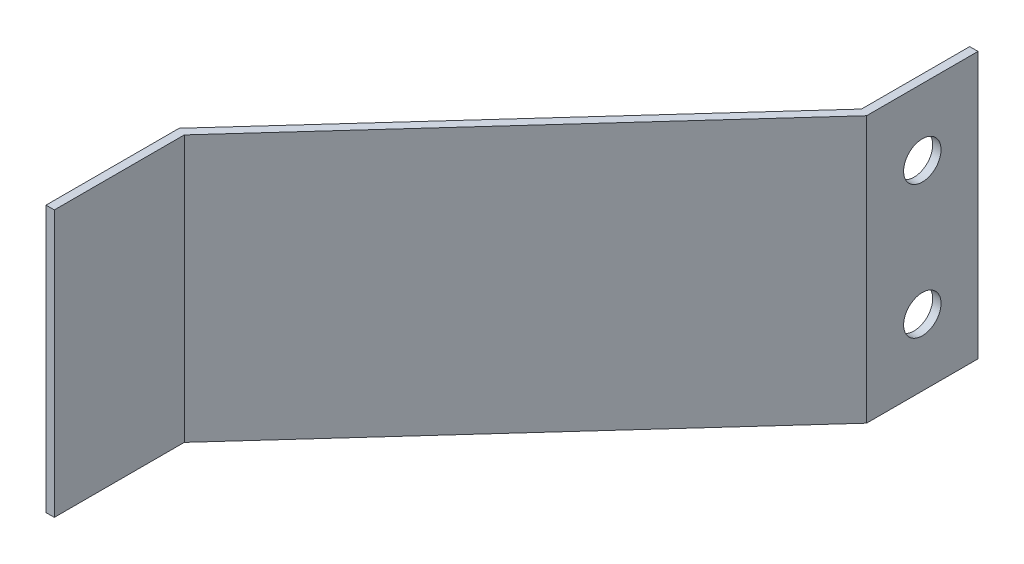
from build123d import *

# Parameters (mm, degrees)
SKETCH1_W           = 127
SKETCH1_H           = 228.6
BOSS_EXTRUDE1_DEPTH = 101.6
CUT_EXTRUDE3_DEPTH  = 188.099924105
SKETCH6_R           = 7.14375
CUT_EXTRUDE4_DEPTH  = 101.6


with BuildPart() as part:
    # Sketch1 → Boss-Extrude1 (new body)
    with BuildSketch(Plane(origin=(0, 0, 0), x_dir=(1, 0, 0), z_dir=(0, 1, 0))):
        with Locations((-25.4, -15.24)):
            Rectangle(SKETCH1_W, SKETCH1_H)
    extrude(amount=BOSS_EXTRUDE1_DEPTH)

    # Sketch3 → Cut-Extrude3 (cut, through all)
    with BuildSketch(Plane(origin=(0, 101.6, 0), x_dir=(1, 0, 0), z_dir=(0, 1, 0))):
        Polygon((34.925, 57.785), (34.925, 99.06), (-88.9, 99.06), (-88.9, -78.74), align=None)
        Polygon((38.1, -129.54), (38.1, 56.559637154), (-85.725, -79.965362846), (-85.725, -129.54), align=None)
    extrude(amount=-CUT_EXTRUDE3_DEPTH, mode=Mode.SUBTRACT)

    # Sketch6 → Cut-Extrude4 (cut)
    with BuildSketch(Plane(origin=(38.1, 0, 0), x_dir=(0, 0, -1), z_dir=(1, 0, 0))):
        with Locations((77.809818577, 76.2)):
            Circle(SKETCH6_R)
        with Locations((77.809818577, 25.4)):
            Circle(SKETCH6_R)
    extrude(amount=-CUT_EXTRUDE4_DEPTH, mode=Mode.SUBTRACT)


solid = part.part
